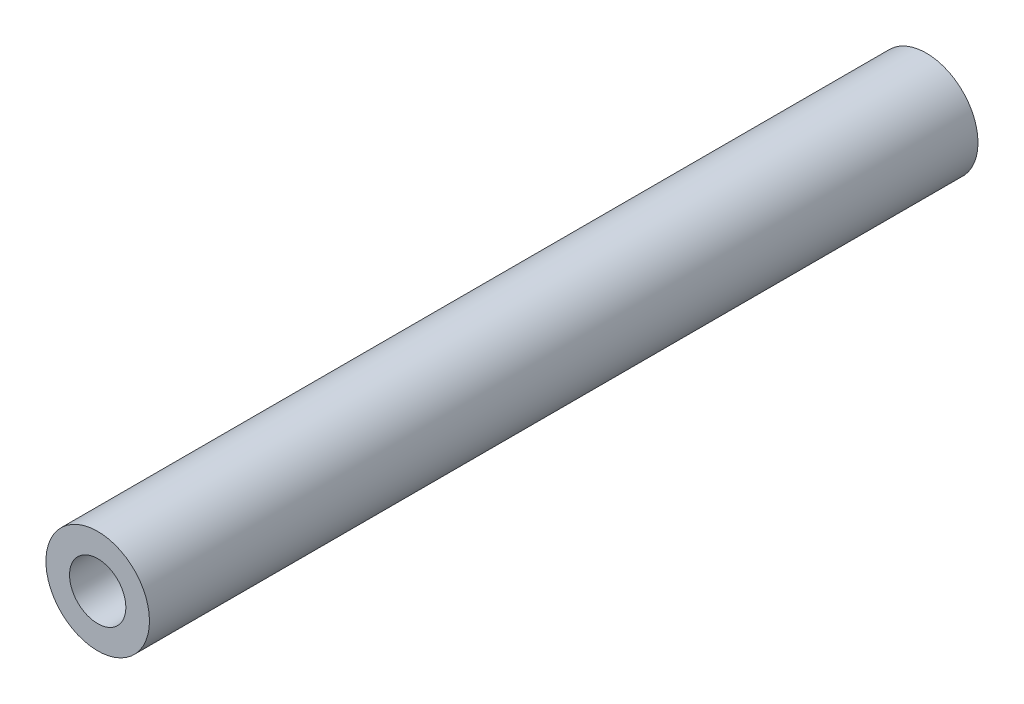
from build123d import *

# Parameters (mm, degrees)
SKETCH1_R                               = 3.175
BOSS_EXTRUDE1_DEPTH                     = 25.4
TAP_DRILL_FOR_8_32_TAP1_D               = 3.4544
TAP_DRILL_FOR_8_32_TAP1_DEPTH           = 6.35
TAP_DRILL_FOR_8_32_TAP1_TIP             = 1.037806461
TAP_DRILL_FOR_8_32_TAP1_ON_FACE_2_D     = 3.4544
TAP_DRILL_FOR_8_32_TAP1_ON_FACE_2_DEPTH = 6.35
TAP_DRILL_FOR_8_32_TAP1_ON_FACE_2_TIP   = 1.037806461


with BuildPart() as part:
    # Sketch1 → Boss-Extrude1 (new, symmetric)
    with BuildSketch(Plane.XY):
        Circle(SKETCH1_R)
    extrude(amount=BOSS_EXTRUDE1_DEPTH, both=True)

    # Tap Drill for #8-32 Tap1
    with Locations(Plane.XY.offset(25.4)):
        with Locations((0, 0)):
            Hole(TAP_DRILL_FOR_8_32_TAP1_D / 2, depth=TAP_DRILL_FOR_8_32_TAP1_DEPTH)
            with Locations((0, 0, -(TAP_DRILL_FOR_8_32_TAP1_DEPTH + TAP_DRILL_FOR_8_32_TAP1_TIP / 2))):  # 118° drill point
                Cone(0, TAP_DRILL_FOR_8_32_TAP1_D / 2, TAP_DRILL_FOR_8_32_TAP1_TIP, mode=Mode.SUBTRACT)

    # Tap Drill for #8-32 Tap1 on face 2
    with Locations(Plane(origin=(0, 0, -25.4), x_dir=(-1, 0, 0), z_dir=(0, 0, -1))):
        with Locations((0, 0)):
            Hole(TAP_DRILL_FOR_8_32_TAP1_ON_FACE_2_D / 2, depth=TAP_DRILL_FOR_8_32_TAP1_ON_FACE_2_DEPTH)
            with Locations((0, 0, -(TAP_DRILL_FOR_8_32_TAP1_ON_FACE_2_DEPTH + TAP_DRILL_FOR_8_32_TAP1_ON_FACE_2_TIP / 2))):  # 118° drill point
                Cone(0, TAP_DRILL_FOR_8_32_TAP1_ON_FACE_2_D / 2, TAP_DRILL_FOR_8_32_TAP1_ON_FACE_2_TIP, mode=Mode.SUBTRACT)


solid = part.part
